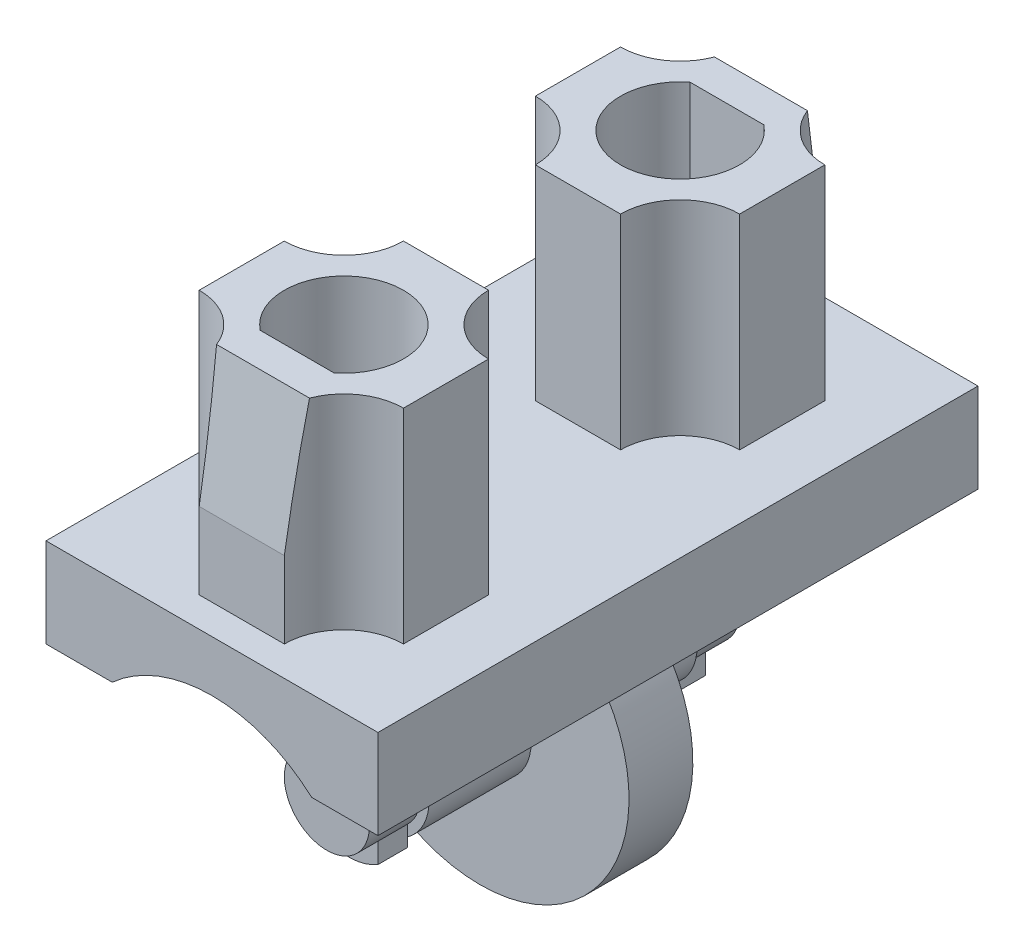
from build123d import *

# Parameters (mm, degrees)
HIP_BASE_DEPTH        = 7.05
SKETCH1_3_R           = 3.5
LEG_JOINT_DEPTH       = 0.75
SKETCH2_R             = 1.2
LEG_PEG_DEPTH         = 2.4
LEG_PEG_INNER_DEPTH   = 1.2
BOSS_EXTRUDE5_DEPTH   = 0.7
HIP_PEG_DEPTH         = 4.8
HIP_CAVITY_DEPTH      = 4.8
HIP_PEG_CHAMFER_DEPTH = 13.456424045


with BuildPart() as part:
    # Sketch1 → Hip Base (new, symmetric)
    with BuildSketch(Plane.XY):
        with BuildLine():
            ThreePointArc((-2.343074903, 2.6), (0, 3.5), (2.343074903, 2.6))
            Line((2.343074903, 2.6), (3.9, 2.6))
            Line((3.9, 2.6), (3.9, 4.7))
            Line((3.9, 4.7), (-3.9, 4.7))
            Line((-3.9, 4.7), (-3.9, 2.6))
            Line((-3.9, 2.6), (-2.343074903, 2.6))
        make_face()
    extrude(amount=HIP_BASE_DEPTH, both=True)

    # Sketch1<3> → Leg Joint (add, symmetric)
    with BuildSketch(Plane.XY):
        Circle(SKETCH1_3_R)
    extrude(amount=LEG_JOINT_DEPTH, both=True)

    # Sketch2 → Leg Peg (add)
    with BuildSketch(Plane.XY.offset(0.75)):
        Circle(SKETCH2_R)
    leg_peg = extrude(amount=LEG_PEG_DEPTH)

    # Sketch3 → Leg Peg Inner (add)
    with BuildSketch(Plane.XY.offset(3.15)):
        with BuildLine():
            Line((-0.661437828, 0.75), (0.661437828, 0.75))
            ThreePointArc((0.661437828, 0.75), (0, -1), (-0.661437828, 0.75))
        make_face()
    leg_peg_inner = extrude(amount=LEG_PEG_INNER_DEPTH)

    # Sketch4 → Boss-Extrude5 (add)
    with BuildSketch(Plane.XY.offset(3.15)):
        with BuildLine():
            Line((-0.7, -0.714142843), (-0.7, -1.1892855))
            ThreePointArc((-0.7, -1.1892855), (0, -1.38), (0.7, -1.1892855))
            Line((0.7, -1.1892855), (0.7, -0.714142843))
            ThreePointArc((0.7, -0.714142843), (0, -1), (-0.7, -0.714142843))
        make_face()
    boss_extrude5 = extrude(amount=BOSS_EXTRUDE5_DEPTH)

    # Sketch7 → Hip Peg (add)
    with BuildSketch(Plane(origin=(0, 4.7, 0), x_dir=(1, 0, 0), z_dir=(0, 1, 0))):
        with BuildLine():
            Line((1, -1.55), (-1, -1.55))
            ThreePointArc((-1, -1.55), (-1.410050506, -2.539949494), (-2.4, -2.95))
            Line((-2.4, -2.95), (-2.4, -4.95))
            ThreePointArc((-2.4, -4.95), (-1.410050506, -5.360050506), (-1, -6.35))
            Line((-1, -6.35), (1, -6.35))
            ThreePointArc((1, -6.35), (1.410050506, -5.360050506), (2.4, -4.95))
            Line((2.4, -4.95), (2.4, -2.95))
            ThreePointArc((2.4, -2.95), (1.410050506, -2.539949494), (1, -1.55))
        make_face()
    hip_peg = extrude(amount=HIP_PEG_DEPTH)

    # Sketch8 → Hip Cavity (cut)
    with BuildSketch(Plane(origin=(0, 9.5, 0), x_dir=(1, 0, 0), z_dir=(0, 1, 0))):
        with BuildLine():
            Line((-0.866025404, -5.05), (0.866025404, -5.05))
            ThreePointArc((0.866025404, -5.05), (0, -2.55), (-0.866025404, -5.05))
        make_face()
    hip_cavity = extrude(amount=-HIP_CAVITY_DEPTH, mode=Mode.SUBTRACT)

    # Sketch9 → Hip Peg Chamfer (cut, symmetric)
    with BuildSketch(Plane(origin=(0, 0, 0), x_dir=(0, 0, -1), z_dir=(1, 0, 0))):
        Polygon((-6.35, 9.5), (-5.85, 9.5), (-6.35, 6.5), align=None)
    hip_peg_chamfer = extrude(amount=HIP_PEG_CHAMFER_DEPTH, both=True, mode=Mode.SUBTRACT)

    # Mirror1: Leg Peg, Leg Peg Inner, Boss-Extrude5, Hip Peg, Hip Cavity, Hip Peg Chamfer across plane
    add(leg_peg.mirror(Plane.XY))
    add(leg_peg_inner.mirror(Plane.XY))
    add(boss_extrude5.mirror(Plane.XY))
    add(hip_peg.mirror(Plane.XY))
    add(hip_cavity.mirror(Plane.XY), mode=Mode.SUBTRACT)
    add(hip_peg_chamfer.mirror(Plane.XY), mode=Mode.SUBTRACT)


solid = part.part
